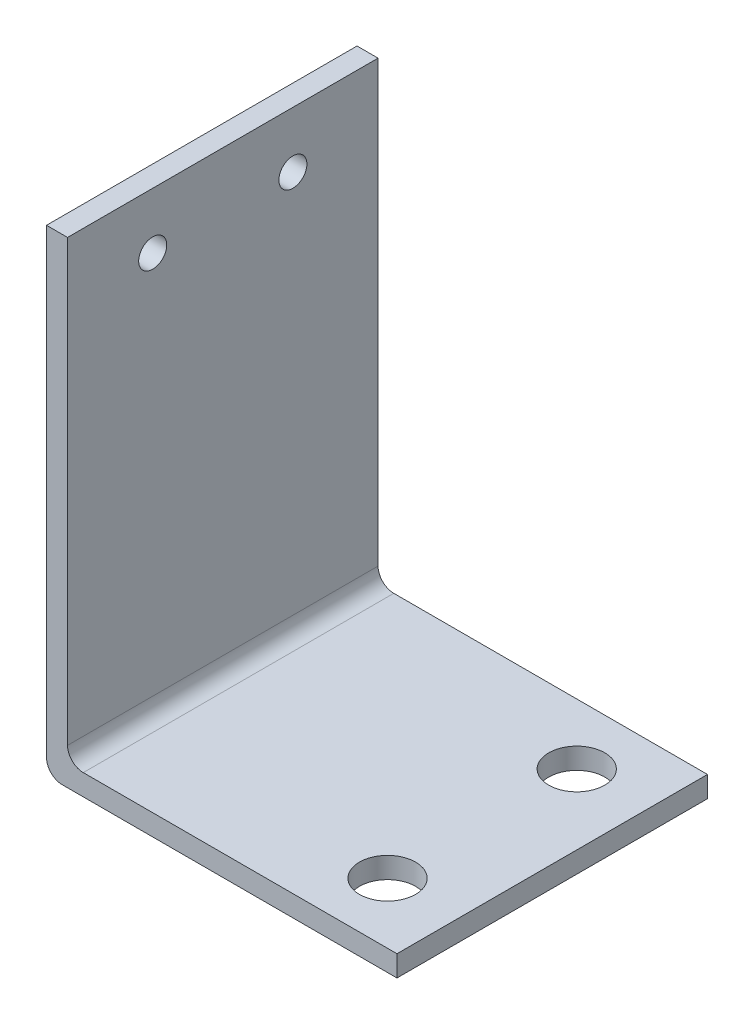
from build123d import *

# Parameters (mm, degrees)
BOSS_EXTRU_1_DEPTH      = 22.15
ESQUISSE2_R             = 2
ENL_V_MAT_EXTRU_1_DEPTH = 47.603352884
ESQUISSE3_R             = 1
ENL_V_MAT_EXTRU_2_DEPTH = 47.892136867


with BuildPart() as part:
    # Esquisse1 → Boss.-Extru.1 (new body)
    with BuildSketch(Plane.XY):
        with BuildLine():
            Line((0, 1.122291019), (0, 34))
            Line((0, 34), (1.5, 34))
            Line((1.5, 34), (1.5, 2.622291019))
            ThreePointArc((1.5, 2.622291019), (1.828711429, 1.828711429), (2.622291019, 1.5))
            Line((2.622291019, 1.5), (25, 1.5))
            Line((25, 1.5), (25, 0))
            Line((25, 0), (1.122291019, 0))
            ThreePointArc((1.122291019, 0), (0.328711429, 0.328711429), (0, 1.122291019))
        make_face()
    extrude(amount=BOSS_EXTRU_1_DEPTH)

    # Esquisse2 → Enlèv. mat.-Extru.1 (cut, through all)
    with BuildSketch(Plane(origin=(0, 1.5, 0), x_dir=(1, 0, 0), z_dir=(0, 1, 0))):
        with Locations(Location((20, -4.325, 0), (0, 0, 270))):
            Circle(ESQUISSE2_R)
        with Locations(Location((20, -17.825, 0), (0, 0, 270))):
            Circle(ESQUISSE2_R)
    extrude(amount=-ENL_V_MAT_EXTRU_1_DEPTH, mode=Mode.SUBTRACT)

    # Esquisse3 → Enlèv. mat.-Extru.2 (cut, through all)
    with BuildSketch(Plane(origin=(1.5, 0, 0), x_dir=(0, 0, -1), z_dir=(1, 0, 0))):
        with Locations((-16.075, 30)):
            Circle(ESQUISSE3_R)
        with Locations((-6.075, 30)):
            Circle(ESQUISSE3_R)
    extrude(amount=-ENL_V_MAT_EXTRU_2_DEPTH, mode=Mode.SUBTRACT)


solid = part.part
